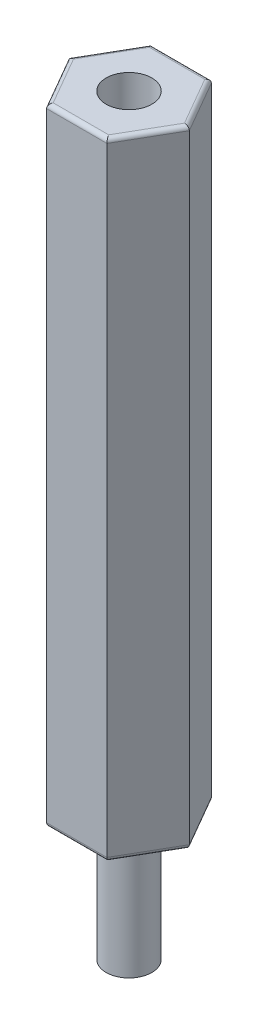
from build123d import *

# Parameters (mm, degrees)
RESSALTO_EXTRUS_O1_DEPTH = 30
FILETE1_R                = 0.2
ESBO_O2_R                = 1.0922
RESSALTO_EXTRUS_O2_DEPTH = 6
ESBO_O3_R                = 1.0922
CORTE_EXTRUS_O1_DEPTH    = 4.76


with BuildPart() as part:
    # Esboço1 → Ressalto-extrusão1 (new body)
    with BuildSketch(Plane(origin=(0, 0, 0), x_dir=(1, 0, 0), z_dir=(0, 1, 0))):
        Polygon((2.886751346, 0), (1.443375673, 2.5), (-1.443375673, 2.5), (-2.886751346, 0), (-1.443375673, -2.5), (1.443375673, -2.5), align=None)
    extrude(amount=RESSALTO_EXTRUS_O1_DEPTH)

    # Filete1
    filete1_edges = [part.edges().sort_by_distance(p)[0] for p in [
        (0, 30, -2.5),
        (-2.165063509, 30, -1.25),
        (-2.165063509, 30, 1.25),
        (0, 30, 2.5),
        (2.165063509, 30, 1.25),
        (0, 0, 2.5),
        (-2.165063509, 0, 1.25),
        (-2.165063509, 0, -1.25),
        (2.165063509, 30, -1.25),
        (0, 0, -2.5),
        (2.165063509, 0, -1.25),
        (2.165063509, 0, 1.25),
    ]]
    fillet(filete1_edges, radius=FILETE1_R)

    # Esboço2 → Ressalto-extrusão2 (add)
    with BuildSketch(Plane.XZ):
        with Locations(Location((0, 0, 0), (0, 0, 90))):
            Circle(ESBO_O2_R)
    extrude(amount=RESSALTO_EXTRUS_O2_DEPTH)

    # Esboço3 → Corte-extrusão1 (cut)
    with BuildSketch(Plane(origin=(0, 30, 0), x_dir=(1, 0, 0), z_dir=(0, 1, 0))):
        with Locations(Location((0, 0, 0), (0, 0, 270))):
            Circle(ESBO_O3_R)
    extrude(amount=-CORTE_EXTRUS_O1_DEPTH, mode=Mode.SUBTRACT)


solid = part.part
